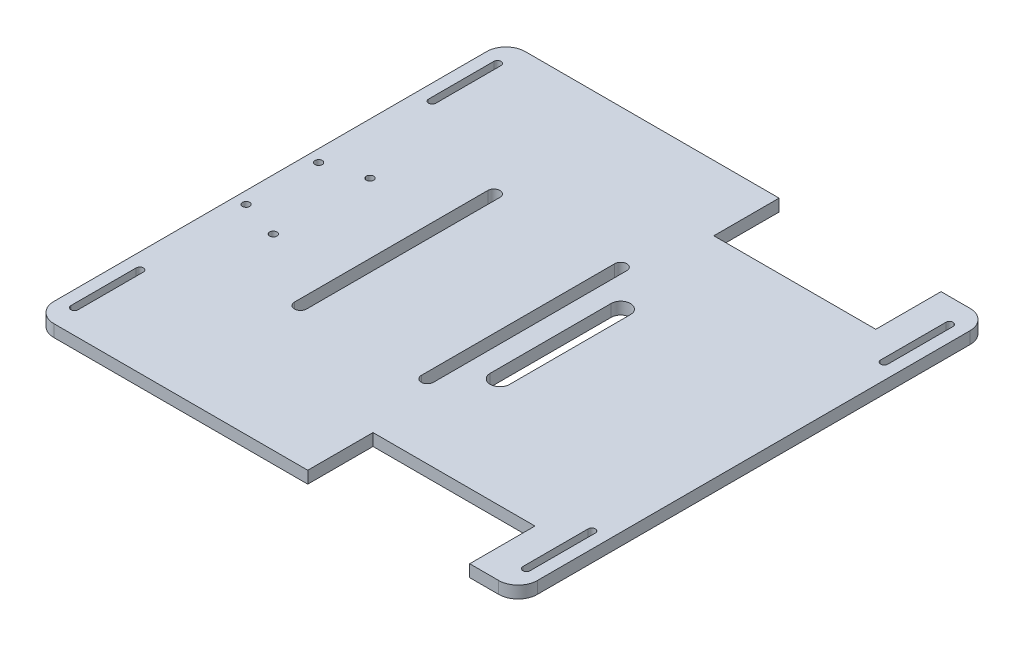
from build123d import *

# Parameters (mm, degrees)
SKETCH2_W           = 200
SKETCH2_H           = 195
BOSS_EXTRUDE1_DEPTH = 5
CUT_EXTRUDE1_DEPTH  = 140.754248594
SKETCH4_W           = 67
SKETCH4_H           = 27
CUT_EXTRUDE2_DEPTH  = 140.754248594
SKETCH8_R           = 1.5
CUT_EXTRUDE6_DEPTH  = 140.754248594
SKETCH9_R           = 1.5
CUT_EXTRUDE7_DEPTH  = 140.754248594
FILLET1_R           = 8


with BuildPart() as part:
    # Sketch2 → Boss-Extrude1 (new body)
    with BuildSketch(Plane(origin=(0, 0, 0), x_dir=(1, 0, 0), z_dir=(0, 1, 0))):
        Rectangle(SKETCH2_W, SKETCH2_H)
    extrude(amount=BOSS_EXTRUDE1_DEPTH)

    # Sketch3 → Cut-Extrude1 (cut, through all)
    with BuildSketch(Plane(origin=(0, 5, 0), x_dir=(1, 0, 0), z_dir=(0, 1, 0))):
        with BuildLine():
            Line((-95, -87.5), (-95, -60.5))
            ThreePointArc((-95, -60.5), (-93.5, -59), (-92, -60.5))
            Line((-92, -60.5), (-92, -87.5))
            ThreePointArc((-92, -87.5), (-93.5, -89), (-95, -87.5))
        make_face()
        with BuildLine():
            Line((-95, 87.5), (-95, 60.5))
            ThreePointArc((-95, 60.5), (-93.5, 59), (-92, 60.5))
            Line((-92, 60.5), (-92, 87.5))
            ThreePointArc((-92, 87.5), (-93.5, 89), (-95, 87.5))
        make_face()
        with BuildLine():
            Line((95, 87.5), (95, 60.5))
            ThreePointArc((95, 60.5), (93.5, 59), (92, 60.5))
            Line((92, 60.5), (92, 87.5))
            ThreePointArc((92, 87.5), (93.5, 89), (95, 87.5))
        make_face()
        with BuildLine():
            Line((95, -87.5), (95, -60.5))
            ThreePointArc((95, -60.5), (93.5, -59), (92, -60.5))
            Line((92, -60.5), (92, -87.5))
            ThreePointArc((92, -87.5), (93.5, -89), (95, -87.5))
        make_face()
    extrude(amount=-CUT_EXTRUDE1_DEPTH, mode=Mode.SUBTRACT)

    # Sketch4 → Cut-Extrude2 (cut, through all)
    with BuildSketch(Plane.XZ):
        with Locations((46.5, -84)):
            Rectangle(SKETCH4_W, SKETCH4_H)
        with Locations((46.5, 84)):
            Rectangle(SKETCH4_W, SKETCH4_H)
        with BuildLine():
            Line((-45, 40), (-45, -40))
            ThreePointArc((-45, -40), (-47.5, -42.5), (-50, -40))
            Line((-50, -40), (-50, 40))
            ThreePointArc((-50, 40), (-47.5, 42.5), (-45, 40))
        make_face()
        with BuildLine():
            Line((24, 25), (24, -25))
            ThreePointArc((24, -25), (20, -29), (16, -25))
            Line((16, -25), (16, 25))
            ThreePointArc((16, 25), (20, 29), (24, 25))
        make_face()
        with BuildLine():
            Line((7.5, 40), (7.5, -40))
            ThreePointArc((7.5, -40), (5, -42.5), (2.5, -40))
            Line((2.5, -40), (2.5, 40))
            ThreePointArc((2.5, 40), (5, 42.5), (7.5, 40))
        make_face()
    extrude(amount=-CUT_EXTRUDE2_DEPTH, mode=Mode.SUBTRACT)

    # Sketch8 → Cut-Extrude6 (cut, through all)
    with BuildSketch(Plane(origin=(0, 5, 0), x_dir=(1, 0, 0), z_dir=(0, 1, 0))):
        with Locations(Location((-78.75, 19.995, 0), (0, 0, 270))):
            Circle(SKETCH8_R)
        with Locations(Location((-78.75, -19.995, 0), (0, 0, 270))):
            Circle(SKETCH8_R)
    extrude(amount=-CUT_EXTRUDE6_DEPTH, mode=Mode.SUBTRACT)

    # Sketch9 → Cut-Extrude7 (cut, through all)
    with BuildSketch(Plane(origin=(0, 5, 0), x_dir=(1, 0, 0), z_dir=(0, 1, 0))):
        with Locations(Location((-95, 15, 0), (0, 0, 270))):
            Circle(SKETCH9_R)
        with Locations(Location((-95, -15, 0), (0, 0, 90))):
            Circle(SKETCH9_R)
    extrude(amount=-CUT_EXTRUDE7_DEPTH, mode=Mode.SUBTRACT)

    # Fillet1
    fillet1_edges = [part.edges().sort_by_distance(p)[0] for p in [
        (100, 2.5, 97.5),
        (-100, 2.5, 97.5),
        (-100, 2.5, -97.5),
        (100, 2.5, -97.5),
    ]]
    fillet(fillet1_edges, radius=FILLET1_R)


solid = part.part
